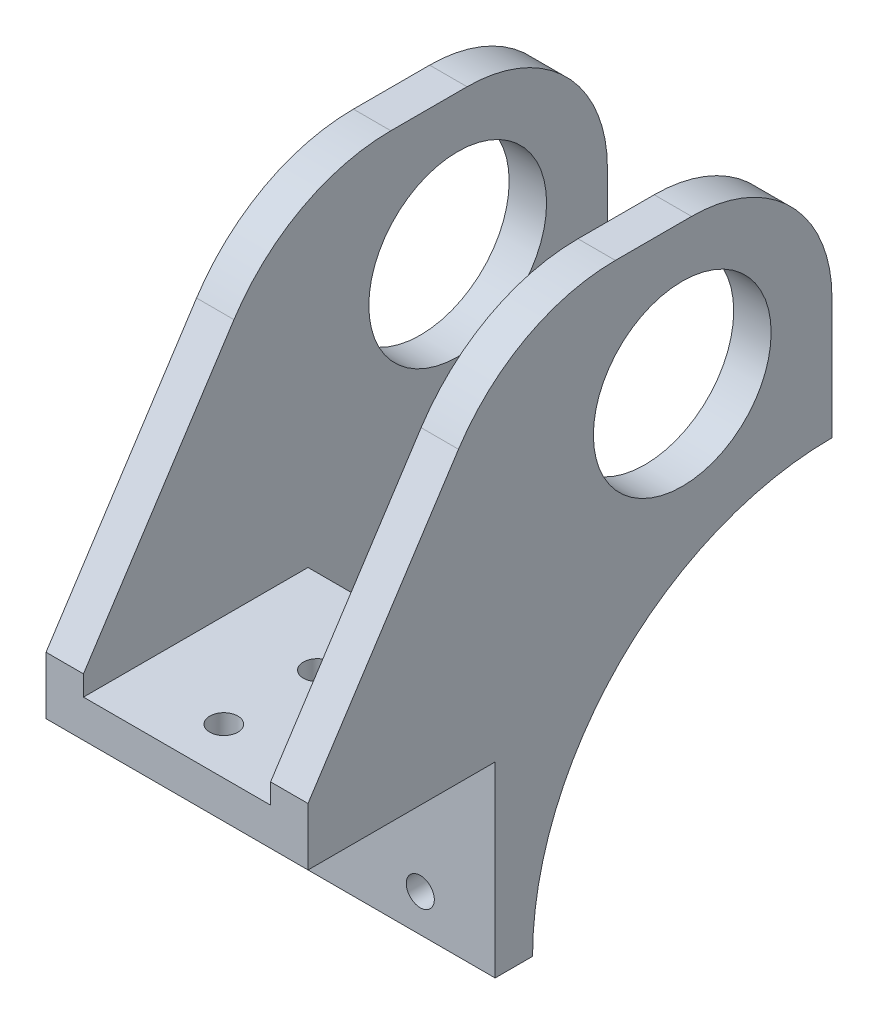
from build123d import *

# Parameters (mm, degrees)
EXTRUDE_1_DEPTH      = 40
SKETCH_2_R           = 9.5
CUT_EXTRUDE_1_DEPTH  = 59.685603004
FILLET_1_R           = 10
SKETCH_5_R           = 1.5
CUT_EXTRUDE_4_DEPTH  = 59.685603004
CUT_EXTRUDE_START    = -1.5
SKETCH_6_R           = 10.5
SKETCH_6_R_2         = 9.5
CUT_EXTRUDE_5_DEPTH  = 1.5
SKETCH_7_W           = 51.462210428
SKETCH_7_H           = 48.175392078
CUT_EXTRUDE_6_DEPTH  = 47
FILLET_2_R           = 10
SKETCH_11_R          = 11.25
SKETCH_11_R_2        = 10.5
EXTRUDE_3_DEPTH      = 1.5
SKETCH_12_R          = 11.25
SKETCH_12_R_2        = 10.5
EXTRUDE_4_DEPTH      = 0.7
SKETCH_13_R          = 10.5
SKETCH_13_R_2        = 9.5
CUT_EXTRUDE_8_DEPTH  = 1
SKETCH_15_R          = 10.5
SKETCH_15_R_2        = 9.5
EXTRUDE_5_DEPTH      = 0.5
SKETCH_17_W          = 12
SKETCH_17_H          = 36.000381057
EXTRUDE_6_DEPTH      = 2
SKETCH_18_W          = 20
SKETCH_18_H          = 36.000381057
CUT_EXTRUDE_9_DEPTH  = 2
SKETCH_19_R          = 1.5
EXTRUDE_7_DEPTH      = 4
EXTRUDE_START        = -4
SKETCH_20_R          = 1.5
EXTRUDE_8_DEPTH      = 4
EXTRUDE_9_DEPTH      = 44
SKETCH_22_W          = 64.499046495
SKETCH_22_H          = 49.763793388
CUT_EXTRUDE_10_DEPTH = 38
SKETCH_23_W          = 12
SKETCH_23_H          = 34.000142893
CUT_EXTRUDE_12_DEPTH = 38
SKETCH_24_W          = 23.945420323
SKETCH_24_H          = 48.426166837
CUT_EXTRUDE_13_DEPTH = 4
SKETCH_25_W          = 20
SKETCH_25_H          = 40
CUT_EXTRUDE_14_DEPTH = 4
EXTRUDE_10_DEPTH     = 4
EXTRUDE_11_DEPTH     = 4
SKETCH_30_R          = 10.5
SKETCH_30_R_2        = 7.5
EXTRUDE_12_DEPTH     = 4
SKETCH_31_R          = 10.5
SKETCH_31_R_2        = 9.5
EXTRUDE_13_DEPTH     = 1
SKETCH_32_R          = 8.25
SKETCH_32_R_2        = 7.5
CUT_EXTRUDE_15_DEPTH = 0.8
SKETCH_34_W          = 20
SKETCH_34_H          = 4
EXTRUDE_14_DEPTH     = 20
SKETCH_37_R          = 9.5
CUT_EXTRUDE_19_DEPTH = 10
SKETCH_38_R          = 10.5
CUT_EXTRUDE_20_DEPTH = 1
SKETCH_39_W          = 4
SKETCH_39_H          = 36
EXTRUDE_15_DEPTH     = 22
SKETCH_40_R          = 9.5
CUT_EXTRUDE_21_DEPTH = 22
SKETCH_41_R          = 9.5
EXTRUDE_16_DEPTH     = 4
SKETCH_44_R          = 10.5
EXTRUDE_17_DEPTH     = 4
EXTRUDE_START_2      = 8
SKETCH_45_R          = 9.5
EXTRUDE_18_DEPTH     = 8
CUT_EXTRUDE_22_DEPTH = 8
SKETCH_50_W          = 4
SKETCH_50_H          = 36
EXTRUDE_19_DEPTH     = 2
EXTRUDE_20_DEPTH     = 4
EXTRUDE_21_DEPTH     = 4
SKETCH_55_R          = 1.5
CUT_EXTRUDE_23_DEPTH = 30
CUT_EXTRUDE_24_DEPTH = 30
FILLET_4_R           = 20
SKETCH_58_W          = 28
SKETCH_58_H          = 20
CUT_EXTRUDE_25_DEPTH = 10
SKETCH_59_W          = 28
SKETCH_59_H          = 4
CUT_EXTRUDE_26_DEPTH = 10
SKETCH_60_R          = 1.5
CUT_EXTRUDE_27_DEPTH = 10
SKETCH_61_R          = 9.5
EXTRUDE_22_DEPTH     = 4
SKETCH_62_R          = 9.5
EXTRUDE_23_DEPTH     = 4
SKETCH_64_W          = 4
SKETCH_64_H          = 36
EXTRUDE_24_DEPTH     = 8
SKETCH_65_R          = 32
CUT_EXTRUDE_28_DEPTH = 39
SKETCH_66_R          = 9.5
CUT_EXTRUDE_29_DEPTH = 41
FILLET_5_R           = 15


with BuildPart() as part:
    # 草图1 → 凸台-拉伸1 (new, symmetric)
    with BuildSketch(Plane.XY):
        Polygon((30, -4), (30, 38), (34, 38), (34, 0), (46, 0), (46, 38), (50, 38), (50, -4), align=None)
    extrude(amount=EXTRUDE_1_DEPTH, both=True)

    # 草图2 → 切除-拉伸1 (cut, through all)
    with BuildSketch(Plane(origin=(50, 0, 0), x_dir=(0, 0, -1), z_dir=(1, 0, 0))):
        with Locations(Location((22, 22, 0), (0, 0, 90))):
            Circle(SKETCH_2_R)
        with Locations(Location((-22, 22, 0), (0, 0, 270))):
            Circle(SKETCH_2_R)
    extrude(amount=-CUT_EXTRUDE_1_DEPTH, mode=Mode.SUBTRACT)

    # 圆角1
    fillet_1_edges = [part.edges().sort_by_distance(p)[0] for p in [
        (32, 38, -40),
        (48, 38, 40),
        (32, 38, 40),
        (48, 38, -40),
    ]]
    fillet(fillet_1_edges, radius=FILLET_1_R)

    # 草图5 → 切除-拉伸4 (cut, through all)
    with BuildSketch(Plane(origin=(50, 0, 0), x_dir=(0, 0, -1), z_dir=(1, 0, 0))):
        with Locations(Location((34.990381057, 29.5, 0), (0, 0, 90))):
            Circle(SKETCH_5_R)
        with Locations(Location((22, 7, 0), (0, 0, 90))):
            Circle(SKETCH_5_R)
        with Locations(Location((9.009618943, 29.5, 0), (0, 0, 90))):
            Circle(SKETCH_5_R)
        with Locations(Location((-34.990381057, 29.5, 0), (0, 0, 270))):
            Circle(SKETCH_5_R)
        with Locations(Location((-22, 7, 0), (0, 0, 270))):
            Circle(SKETCH_5_R)
        with Locations(Location((-9.009618943, 29.5, 0), (0, 0, 270))):
            Circle(SKETCH_5_R)
    extrude(amount=-CUT_EXTRUDE_4_DEPTH, mode=Mode.SUBTRACT)

    # 草图6 → 切除-拉伸5 (cut)
    # profile 1 of 2: a face of its own
    with BuildSketch(Plane.ZY.offset(-30).offset(CUT_EXTRUDE_START)):
        with Locations((-22, 22)):
            Circle(SKETCH_6_R)
        with Locations((-22, 22)):
            Circle(SKETCH_6_R_2, mode=Mode.SUBTRACT)
    # profile 2 of 2: a face of its own
    with BuildSketch(Plane.ZY.offset(-30).offset(CUT_EXTRUDE_START)):
        with Locations((22, 22)):
            Circle(SKETCH_6_R)
        with Locations((22, 22)):
            Circle(SKETCH_6_R_2, mode=Mode.SUBTRACT)
    extrude(amount=CUT_EXTRUDE_5_DEPTH, mode=Mode.SUBTRACT)

    # 草图7 → 切除-拉伸6 (cut)
    with BuildSketch(Plane(origin=(50, 0, 0), x_dir=(0, 0, -1), z_dir=(1, 0, 0))):
        with Locations((-21.731486271, 13.912303961)):
            Rectangle(SKETCH_7_W, SKETCH_7_H)
    extrude(amount=-CUT_EXTRUDE_6_DEPTH, mode=Mode.SUBTRACT)

    # 圆角2
    fillet_2_edges = [part.edges().sort_by_distance(p)[0] for p in [
        (32, 38, -3.999618943),
        (48, 38, -3.999618943),
    ]]
    fillet(fillet_2_edges, radius=FILLET_2_R)

    # 草图11 → 凸台-拉伸3 (add)
    with BuildSketch(Plane.ZY.offset(-31.5)):
        with Locations((-22, 22)):
            Circle(SKETCH_11_R)
        with Locations((-22, 22)):
            Circle(SKETCH_11_R_2, mode=Mode.SUBTRACT)
    extrude(amount=EXTRUDE_3_DEPTH)

    # 草图12 → 凸台-拉伸4 (add)
    with BuildSketch(Plane.ZY.offset(-31.5)):
        with Locations((-22, 22)):
            Circle(SKETCH_12_R)
        with Locations((-22, 22)):
            Circle(SKETCH_12_R_2, mode=Mode.SUBTRACT)
    extrude(amount=EXTRUDE_4_DEPTH)

    # 草图13 → 切除-拉伸8 (cut)
    with BuildSketch(Plane(origin=(50, 0, 0), x_dir=(0, 0, -1), z_dir=(1, 0, 0))):
        with Locations(Location((22, 22, 0), (0, 0, 180))):
            Circle(SKETCH_13_R)
        with Locations(Location((22, 22, 0), (0, 0, 90))):
            Circle(SKETCH_13_R_2, mode=Mode.SUBTRACT)
    extrude(amount=-CUT_EXTRUDE_8_DEPTH, mode=Mode.SUBTRACT)

    # 草图15 → 凸台-拉伸5 (add)
    with BuildSketch(Plane.ZY.offset(-31.5)):
        with Locations((-22, 22)):
            Circle(SKETCH_15_R)
        with Locations(Location((-22, 22, 0), (0, 0, 90))):
            Circle(SKETCH_15_R_2, mode=Mode.SUBTRACT)
    extrude(amount=EXTRUDE_5_DEPTH)

    # 草图17 → 凸台-拉伸6 (add)
    with BuildSketch(Plane(origin=(0, 0, 0), x_dir=(1, 0, 0), z_dir=(0, 1, 0))):
        with Locations((40, 21.999809472)):
            Rectangle(SKETCH_17_W, SKETCH_17_H)
    extrude(amount=EXTRUDE_6_DEPTH)

    # 草图18 → 切除-拉伸9 (cut)
    with BuildSketch(Plane.XZ.offset(4)):
        with Locations((40, -21.999809472)):
            Rectangle(SKETCH_18_W, SKETCH_18_H)
    extrude(amount=-CUT_EXTRUDE_9_DEPTH, mode=Mode.SUBTRACT)

    # 草图19 → 凸台-拉伸7 (add)
    with BuildSketch(Plane(origin=(50, 0, 0), x_dir=(0, 0, -1), z_dir=(1, 0, 0))):
        with Locations(Location((34.990381057, 29.5, 0), (0, 0, 90))):
            Circle(SKETCH_19_R)
        with Locations(Location((9.009618943, 29.5, 0), (0, 0, 90))):
            Circle(SKETCH_19_R)
        with Locations(Location((22, 7, 0), (0, 0, 90))):
            Circle(SKETCH_19_R)
    extrude(amount=-EXTRUDE_7_DEPTH)

    # 草图20 → 凸台-拉伸8 (add)
    with BuildSketch(Plane.ZY.offset(-30).offset(EXTRUDE_START)):
        with Locations((-9.009618943, 29.5)):
            Circle(SKETCH_20_R)
        with Locations((-22, 7)):
            Circle(SKETCH_20_R)
        with Locations((-34.990381057, 29.5)):
            Circle(SKETCH_20_R)
    extrude(amount=EXTRUDE_8_DEPTH)

    # 草图21 → 凸台-拉伸9 (add)
    with BuildSketch(Plane.ZY.offset(-30)):
        with BuildLine():
            Line((-40, -2), (-35.999809472, -2))
            Line((-35.999809472, -2), (-35.999809472, 36.000142893))
            ThreePointArc((-35.999809472, 36.000142893), (-38.944218656, 32.472242462), (-40, 28))
            Line((-40, 28), (-40, -2))
        make_face()
        with BuildLine():
            Line((-7.999809472, 36.000142893), (-7.999809472, -2))
            Line((-7.999809472, -2), (-3.999618943, -2))
            Line((-3.999618943, -2), (-3.999618943, 28))
            ThreePointArc((-3.999618943, 28), (-5.055400288, 32.472242462), (-7.999809472, 36.000142893))
        make_face()
    extrude(amount=-EXTRUDE_9_DEPTH)

    # 草图22 → 切除-拉伸10 (cut)
    with BuildSketch(Plane(origin=(50, 0, 0), x_dir=(0, 0, -1), z_dir=(1, 0, 0))):
        with Locations((27.945354193, 20.62989223)):
            Rectangle(SKETCH_22_W, SKETCH_22_H)
    extrude(amount=CUT_EXTRUDE_10_DEPTH, mode=Mode.SUBTRACT)

    # 草图23 → 切除-拉伸12 (cut)
    with BuildSketch(Plane.XY.offset(-3.999618943)):
        with Locations((40, 19.000071447)):
            Rectangle(SKETCH_23_W, SKETCH_23_H)
    extrude(amount=-CUT_EXTRUDE_12_DEPTH, mode=Mode.SUBTRACT)

    # 草图24 → 切除-拉伸13 (cut)
    with BuildSketch(Plane.XY.offset(-3.999618943)):
        with Locations((41.972710162, 22.213083419)):
            Rectangle(SKETCH_24_W, SKETCH_24_H)
    extrude(amount=-CUT_EXTRUDE_13_DEPTH, mode=Mode.SUBTRACT)

    # 草图25 → 切除-拉伸14 (cut)
    with BuildSketch(Plane(origin=(0, 0, -40), x_dir=(-1, 0, 0), z_dir=(0, 0, -1))):
        with Locations((-40, 18)):
            Rectangle(SKETCH_25_W, SKETCH_25_H)
    extrude(amount=-CUT_EXTRUDE_14_DEPTH, mode=Mode.SUBTRACT)

    # 草图26 → 凸台-拉伸10 (add)
    with BuildSketch(Plane(origin=(50, 0, 0), x_dir=(0, 0, -1), z_dir=(1, 0, 0))):
        with BuildLine():
            Line((13.999618943, 38), (7.999618943, 38))
            Line((7.999618943, 38), (7.999618943, 36))
            ThreePointArc((7.999618943, 36), (10.837341283, 37.486832981), (13.999618943, 38))
        make_face()
        with BuildLine():
            Line((30, 38), (36, 38))
            Line((36, 38), (36, 36))
            ThreePointArc((36, 36), (33.16227766, 37.486832981), (30, 38))
        make_face()
    extrude(amount=-EXTRUDE_10_DEPTH)

    # 草图27 → 凸台-拉伸11 (add)
    with BuildSketch(Plane.ZY.offset(-30)):
        with BuildLine():
            Line((-7.999618943, 38), (-13.999618943, 38))
            ThreePointArc((-13.999618943, 38), (-10.837341283, 37.486832981), (-7.999618943, 36))
            Line((-7.999618943, 36), (-7.999618943, 38))
        make_face()
        with BuildLine():
            Line((-36, 38), (-30, 38))
            ThreePointArc((-30, 38), (-33.16227766, 37.486832981), (-36, 36))
            Line((-36, 36), (-36, 38))
        make_face()
    extrude(amount=-EXTRUDE_11_DEPTH)

    # 草图30 → 凸台-拉伸12 (add)
    with BuildSketch(Plane(origin=(50, 0, 0), x_dir=(0, 0, -1), z_dir=(1, 0, 0))):
        with Locations(Location((22, 22, 0), (0, 0, 180))):
            Circle(SKETCH_30_R)
        with Locations(Location((22, 22, 0), (0, 0, 90))):
            Circle(SKETCH_30_R_2, mode=Mode.SUBTRACT)
    extrude(amount=-EXTRUDE_12_DEPTH)

    # 草图31 → 凸台-拉伸13 (add)
    with BuildSketch(Plane.ZY.offset(-31)):
        with Locations((-22, 22)):
            Circle(SKETCH_31_R)
        with Locations((-22, 22)):
            Circle(SKETCH_31_R_2, mode=Mode.SUBTRACT)
    extrude(amount=EXTRUDE_13_DEPTH)

    # 草图32 → 切除-拉伸15 (cut)
    with BuildSketch(Plane(origin=(50, 0, 0), x_dir=(0, 0, -1), z_dir=(1, 0, 0))):
        with Locations(Location((22, 22, 0), (0, 0, 90))):
            Circle(SKETCH_32_R)
        with Locations(Location((22, 22, 0), (0, 0, 90))):
            Circle(SKETCH_32_R_2, mode=Mode.SUBTRACT)
    extrude(amount=-CUT_EXTRUDE_15_DEPTH, mode=Mode.SUBTRACT)

    # 草图34 → 凸台-拉伸14 (add)
    with BuildSketch(Plane.XZ.offset(2)):
        with Locations((40, -9.999618943)):
            Rectangle(SKETCH_34_W, SKETCH_34_H)
        with Locations((40, -34)):
            Rectangle(SKETCH_34_W, SKETCH_34_H)
    extrude(amount=EXTRUDE_14_DEPTH)

    # 草图37 → 切除-拉伸19 (cut)
    with BuildSketch(Plane(origin=(50, 0, 0), x_dir=(0, 0, -1), z_dir=(1, 0, 0))):
        with Locations(Location((22, 22, 0), (0, 0, 180))):
            Circle(SKETCH_37_R)
    extrude(amount=-CUT_EXTRUDE_19_DEPTH, mode=Mode.SUBTRACT)

    # 草图38 → 切除-拉伸20 (cut)
    with BuildSketch(Plane(origin=(50, 0, 0), x_dir=(0, 0, -1), z_dir=(1, 0, 0))):
        with Locations(Location((22, 22, 0), (0, 0, 90))):
            Circle(SKETCH_38_R)
    extrude(amount=-CUT_EXTRUDE_20_DEPTH, mode=Mode.SUBTRACT)

    # 草图39 → 凸台-拉伸15 (add)
    with BuildSketch(Plane(origin=(0, 0, -36), x_dir=(-1, 0, 0), z_dir=(0, 0, -1))):
        with Locations((-48, 20)):
            Rectangle(SKETCH_39_W, SKETCH_39_H)
        with Locations((-32, 20)):
            Rectangle(SKETCH_39_W, SKETCH_39_H)
    extrude(amount=EXTRUDE_15_DEPTH)

    # 草图40 → 切除-拉伸21 (cut)
    with BuildSketch(Plane.ZY.offset(-30)):
        with Locations((-44, 22)):
            Circle(SKETCH_40_R)
    extrude(amount=-CUT_EXTRUDE_21_DEPTH, mode=Mode.SUBTRACT)

    # 草图41 → 凸台-拉伸16 (add)
    with BuildSketch(Plane.ZY.offset(-30).offset(EXTRUDE_START)):
        with Locations(Location((-22, 22, 0), (0, 0, 90))):
            Circle(SKETCH_41_R)
    extrude(amount=EXTRUDE_16_DEPTH)

    # 草图44 → 凸台-拉伸17 (add)
    with BuildSketch(Plane(origin=(50, 0, 0), x_dir=(0, 0, -1), z_dir=(1, 0, 0))):
        with Locations((22, 22)):
            Circle(SKETCH_44_R)
    extrude(amount=-EXTRUDE_17_DEPTH)

    # 草图45 → 凸台-拉伸18 (add)
    with BuildSketch(Plane.ZY.offset(-30).offset(EXTRUDE_START_2)):
        Polygon((-7.999618943, 38), (-58, 38), (-58, 2), (-36, 2), (-36, -22), (-32, -22), (-32, -2), (-11.999618943, -2), (-11.999618943, -22), (-7.999618943, -22), align=None)
        with Locations((-44, 22)):
            Circle(SKETCH_45_R, mode=Mode.SUBTRACT)
    extrude(amount=-EXTRUDE_18_DEPTH)

    # 草图46 → 切除-拉伸22 (cut)
    with BuildSketch(Plane(origin=(34, 0, 0), x_dir=(0, 0, -1), z_dir=(1, 0, 0))):
        Polygon((7.999618943, 2), (36, 2), (58, 2), (58, 38), (7.999618943, 38), align=None)
    extrude(amount=-CUT_EXTRUDE_22_DEPTH, mode=Mode.SUBTRACT)

    # 草图50 → 凸台-拉伸19 (add)
    with BuildSketch(Plane(origin=(0, 0, -58), x_dir=(-1, 0, 0), z_dir=(0, 0, -1))):
        with Locations((-48, 20)):
            Rectangle(SKETCH_50_W, SKETCH_50_H)
        with Locations((-24, 20)):
            Rectangle(SKETCH_50_W, SKETCH_50_H)
    extrude(amount=EXTRUDE_19_DEPTH)

    # 草图51 → 凸台-拉伸20 (add)
    with BuildSketch(Plane.ZY.offset(-22)):
        with BuildLine():
            Line((-60, 2), (-36, 2))
            Line((-36, 2), (-36, -22))
            ThreePointArc((-36, -22), (-43.029437252, -5.029437252), (-60, 2))
        make_face()
    extrude(amount=-EXTRUDE_20_DEPTH)

    # 草图54 → 凸台-拉伸21 (add)
    with BuildSketch(Plane(origin=(50, 0, 0), x_dir=(0, 0, -1), z_dir=(1, 0, 0)).offset(EXTRUDE_START)):
        with BuildLine():
            Line((36, 2), (36, -22))
            ThreePointArc((36, -22), (43.029437252, -5.029437252), (60, 2))
            Line((60, 2), (36, 2))
        make_face()
    extrude(amount=EXTRUDE_21_DEPTH)

    # 草图55 → 切除-拉伸23 (cut)
    with BuildSketch(Plane.XY.offset(-7.999618943)):
        with Locations((30, -6)):
            Circle(SKETCH_55_R)
        with Locations((42, -6)):
            Circle(SKETCH_55_R)
        with Locations((42, -18)):
            Circle(SKETCH_55_R)
        with Locations((30, -18)):
            Circle(SKETCH_55_R)
    extrude(amount=-CUT_EXTRUDE_23_DEPTH, mode=Mode.SUBTRACT)

    # 草图57 → 切除-拉伸24 (cut)
    with BuildSketch(Plane.ZY.offset(-22)):
        Polygon((-7.999618943, -2), (-33.999809472, 38), (-7.999618943, 38), align=None)
    extrude(amount=-CUT_EXTRUDE_24_DEPTH, mode=Mode.SUBTRACT)

    # 圆角4
    fillet_4_edges = [part.edges().sort_by_distance(p)[0] for p in [
        (48, 38, -33.999809472),
        (24, 38, -33.999809472),
    ]]
    fillet(fillet_4_edges, radius=FILLET_4_R)

    # 草图58 → 切除-拉伸25 (cut)
    with BuildSketch(Plane(origin=(0, 0, -11.999618943), x_dir=(-1, 0, 0), z_dir=(0, 0, -1))):
        with Locations((-36, -12)):
            Rectangle(SKETCH_58_W, SKETCH_58_H)
    extrude(amount=-CUT_EXTRUDE_25_DEPTH, mode=Mode.SUBTRACT)

    # 草图59 → 切除-拉伸26 (cut)
    with BuildSketch(Plane.XZ.offset(2)):
        with Locations((36, -9.999618943)):
            Rectangle(SKETCH_59_W, SKETCH_59_H)
    extrude(amount=-CUT_EXTRUDE_26_DEPTH, mode=Mode.SUBTRACT)

    # 草图60 → 切除-拉伸27 (cut)
    with BuildSketch(Plane.XZ.offset(2)):
        with Locations((36, -16.999618943)):
            Circle(SKETCH_60_R)
        with Locations((36, -26.999618943)):
            Circle(SKETCH_60_R)
    extrude(amount=-CUT_EXTRUDE_27_DEPTH, mode=Mode.SUBTRACT)

    # 草图61 → 凸台-拉伸22 (add)
    with BuildSketch(Plane.ZY.offset(-22)):
        with Locations(Location((-44, 22, 0), (0, 0, 270))):
            Circle(SKETCH_61_R)
    extrude(amount=-EXTRUDE_22_DEPTH)

    # 草图62 → 凸台-拉伸23 (add)
    with BuildSketch(Plane(origin=(50, 0, 0), x_dir=(0, 0, -1), z_dir=(1, 0, 0)).offset(EXTRUDE_START)):
        with Locations((44, 22)):
            Circle(SKETCH_62_R)
    extrude(amount=EXTRUDE_23_DEPTH)

    # 草图64 → 凸台-拉伸24 (add)
    with BuildSketch(Plane(origin=(0, 0, -60), x_dir=(-1, 0, 0), z_dir=(0, 0, -1))):
        with Locations((-24, 20)):
            Rectangle(SKETCH_64_W, SKETCH_64_H)
        with Locations((-48, 20)):
            Rectangle(SKETCH_64_W, SKETCH_64_H)
    extrude(amount=EXTRUDE_24_DEPTH)

    # 草图65 → 切除-拉伸28 (cut)
    with BuildSketch(Plane(origin=(50, 0, 0), x_dir=(0, 0, -1), z_dir=(1, 0, 0))):
        with Locations((68, -22)):
            Circle(SKETCH_65_R)
    extrude(amount=-CUT_EXTRUDE_28_DEPTH, mode=Mode.SUBTRACT)

    # 草图66 → 切除-拉伸29 (cut)
    with BuildSketch(Plane(origin=(50, 0, 0), x_dir=(0, 0, -1), z_dir=(1, 0, 0))):
        with Locations(Location((51.999618943, 23, 0), (0, 0, 90))):
            Circle(SKETCH_66_R)
    extrude(amount=-CUT_EXTRUDE_29_DEPTH, mode=Mode.SUBTRACT)

    # 圆角5
    fillet_5_edges = [part.edges().sort_by_distance(p)[0] for p in [
        (24, 38, -68),
        (48, 38, -68),
    ]]
    fillet(fillet_5_edges, radius=FILLET_5_R)


solid = part.part
